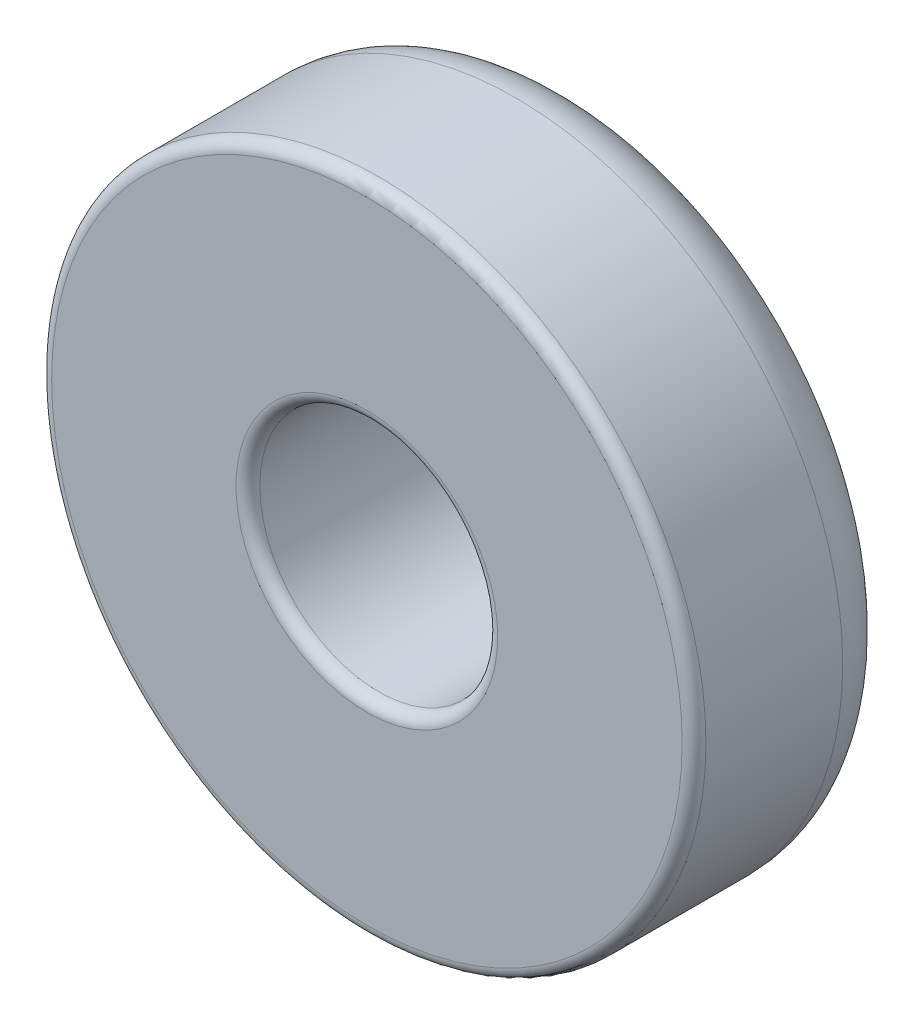
from build123d import *

# Parameters (mm, degrees)
SKETCH1_R           = 2.75
SKETCH1_R_2         = 1
EXTRUDE_THIN2_DEPTH = 1.75
FILLET1_R           = 0.5
FILLET2_R           = 0.1


with BuildPart() as part:
    # Sketch1 → Extrude-Thin2 (new body)
    with BuildSketch(Plane.XY):
        Circle(SKETCH1_R)
        Circle(SKETCH1_R_2, mode=Mode.SUBTRACT)
    extrude(amount=EXTRUDE_THIN2_DEPTH)

    # Fillet1
    fillet1_edges = [part.edges().sort_by_distance(p)[0] for p in [
        (-2.75, 0, 0),
    ]]
    fillet(fillet1_edges, radius=FILLET1_R)

    # Fillet2
    fillet2_edges = [part.edges().sort_by_distance(p)[0] for p in [
        (-2.75, 0, 1.75),
        (-1, 0, 0),
        (-1, 0, 1.75),
    ]]
    fillet(fillet2_edges, radius=FILLET2_R)


solid = part.part
